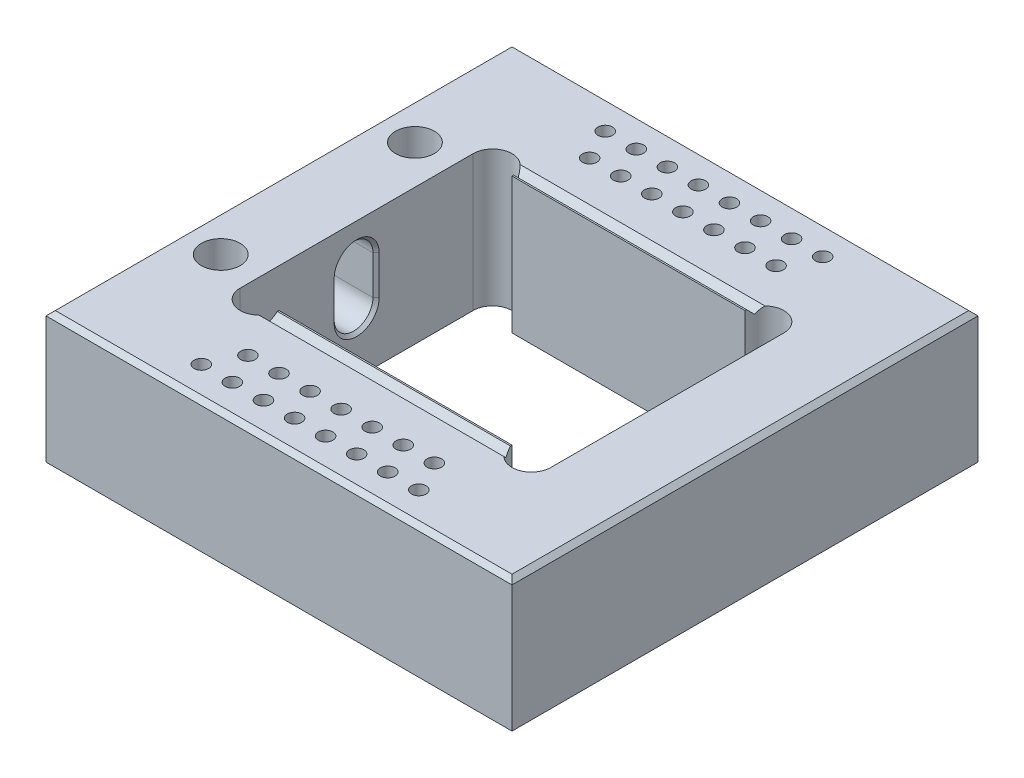
from build123d import *

# Parameters (mm, degrees)
SKETCH1_W                       = 76.2
SKETCH1_H                       = 76.2
BOSS_EXTRUDE1_DEPTH             = 22.225
SKETCH2_W                       = 44.45
SKETCH2_H                       = 38.1
CUT_EXTRUDE1_DEPTH              = 59.285252208
CUT_EXTRUDE2_DEPTH              = 59.285252208
F_3_32_0_09375_DIAMETER_HOLE1_D = 2.38125
CUT_EXTRUDE4_DEPTH              = 21.59
CUT_EXTRUDE5_REACH              = 79.316
CHAMFER1_SIZE                   = 0.762
CHAMFER2_SIZE                   = 0.508
F_1_4_0_25_DIAMETER_HOLE1_D     = 6.35
F_1_4_0_25_DIAMETER_HOLE1_DEPTH = 16.51
F_1_4_0_25_DIAMETER_HOLE1_TIP   = 1.907732465


with BuildPart() as part:
    # Sketch1 → Boss-Extrude1 (new body)
    with BuildSketch(Plane(origin=(0, 0, 0), x_dir=(1, 0, 0), z_dir=(0, 1, 0))):
        Rectangle(SKETCH1_W, SKETCH1_H)
    extrude(amount=BOSS_EXTRUDE1_DEPTH)

    # Sketch2 → Cut-Extrude1 (cut, through all)
    with BuildSketch(Plane(origin=(0, 22.225, 0), x_dir=(1, 0, 0), z_dir=(0, 1, 0))):
        Rectangle(SKETCH2_W, SKETCH2_H)
    extrude(amount=-CUT_EXTRUDE1_DEPTH, mode=Mode.SUBTRACT)

    # Sketch3 → Cut-Extrude2 (cut, through all)
    with BuildSketch(Plane(origin=(0, 22.225, 0), x_dir=(1, 0, 0), z_dir=(0, 1, 0))):
        with BuildLine():
            Line((-19.05, 19.05), (-19.05, -19.05))
            ThreePointArc((-19.05, -19.05), (-22.225, -22.225), (-25.4, -19.05))
            Line((-25.4, -19.05), (-25.4, 19.05))
            ThreePointArc((-25.4, 19.05), (-22.225, 22.225), (-19.05, 19.05))
        make_face()
        with BuildLine():
            Line((25.4, 19.05), (25.4, -19.05))
            ThreePointArc((25.4, -19.05), (22.225, -22.225), (19.05, -19.05))
            Line((19.05, -19.05), (19.05, 19.05))
            ThreePointArc((19.05, 19.05), (22.225, 22.225), (25.4, 19.05))
        make_face()
    extrude(amount=-CUT_EXTRUDE2_DEPTH, mode=Mode.SUBTRACT)

    # 3/32 (0.09375) Diameter Hole1 (through all)
    with Locations(Plane(origin=(0, 22.225, 0), x_dir=(1, 0, 0), z_dir=(0, 1, 0))):
        with Locations((-15.24, 27.94), (15.24, 27.94), (-17.78, 33.02), (17.78, 33.02), (-12.7, 33.02), (-7.62, 33.02), (-2.54, 33.02), (2.54, 33.02), (7.62, 33.02), (12.7, 33.02), (-10.16, 27.94), (-5.08, 27.94), (0, 27.94), (5.08, 27.94), (10.16, 27.94)):
            f_3_32_0_09375_diameter_hole1 = Hole(F_3_32_0_09375_DIAMETER_HOLE1_D / 2)

    # Mirror1: 3/32 (0.09375) Diameter Hole1 across plane
    add(f_3_32_0_09375_diameter_hole1.mirror(Plane.XY), mode=Mode.SUBTRACT)

    # Sketch8 → Cut-Extrude4 (cut, symmetric)
    with BuildSketch(Plane(origin=(0, 0, 0), x_dir=(0, 0, -1), z_dir=(1, 0, 0))):
        Polygon((19.304, 22.225), (20.32, 21.209), (21.336, 22.225), align=None)
    cut_extrude4 = extrude(amount=CUT_EXTRUDE4_DEPTH, both=True, mode=Mode.SUBTRACT)

    # Mirror2: Cut-Extrude4 across plane
    add(cut_extrude4.mirror(Plane.XY), mode=Mode.SUBTRACT)

    # Sketch9 → Cut-Extrude5 (cut, up to next)
    with BuildSketch(Plane(origin=(-25.4, 0, 0), x_dir=(0, 0, -1), z_dir=(1, 0, 0)), mode=Mode.PRIVATE) as cut_extrude5_sk1:
        with BuildLine():
            Line((3.175, 15.875), (3.175, 9.525))
            ThreePointArc((3.175, 9.525), (0, 6.35), (-3.175, 9.525))
            Line((-3.175, 9.525), (-3.175, 15.875))
            ThreePointArc((-3.175, 15.875), (0, 19.05), (3.175, 15.875))
        make_face()
    cut_extrude5_tool1 = extrude(cut_extrude5_sk1.sketch, amount=-CUT_EXTRUDE5_REACH, mode=Mode.PRIVATE) & part.part
    add(cut_extrude5_tool1.solids().sort_by_distance((-25.4, 12.7, 0))[0], mode=Mode.SUBTRACT)

    # Chamfer1
    chamfer1_edges = [part.edges().sort_by_distance(p)[0] for p in [
        (-38.1, 22.225, 0),
        (0, 22.225, 38.1),
        (38.1, 22.225, 0),
        (0, 0, 38.1),
        (-38.1, 0, 0),
        (0, 0, -38.1),
        (38.1, 0, 0),
        (0, 22.225, -38.1),
    ]]
    chamfer(chamfer1_edges, length=CHAMFER1_SIZE)

    # Chamfer2
    chamfer2_edges = [part.edges().sort_by_distance(p)[0] for p in [
        (-25.4, 19.05, 0),
        (-25.4, 12.7, 3.175),
        (-25.4, 6.35, 0),
        (-25.4, 12.7, -3.175),
        (-38.1, 12.7, 3.175),
        (-38.1, 19.05, 0),
        (-38.1, 12.7, -3.175),
        (-38.1, 6.35, 0),
    ]]
    chamfer(chamfer2_edges, length=CHAMFER2_SIZE)

    # 1/4 (0.25) Diameter Hole1
    with Locations(Plane(origin=(0, 22.225, 0), x_dir=(1, 0, 0), z_dir=(0, 1, 0))):
        with Locations((-31.75, 15.875), (-31.75, -15.875)):
            Hole(F_1_4_0_25_DIAMETER_HOLE1_D / 2, depth=F_1_4_0_25_DIAMETER_HOLE1_DEPTH)
            with Locations((0, 0, -(F_1_4_0_25_DIAMETER_HOLE1_DEPTH + F_1_4_0_25_DIAMETER_HOLE1_TIP / 2))):  # 118° drill point
                Cone(0, F_1_4_0_25_DIAMETER_HOLE1_D / 2, F_1_4_0_25_DIAMETER_HOLE1_TIP, mode=Mode.SUBTRACT)


solid = part.part
